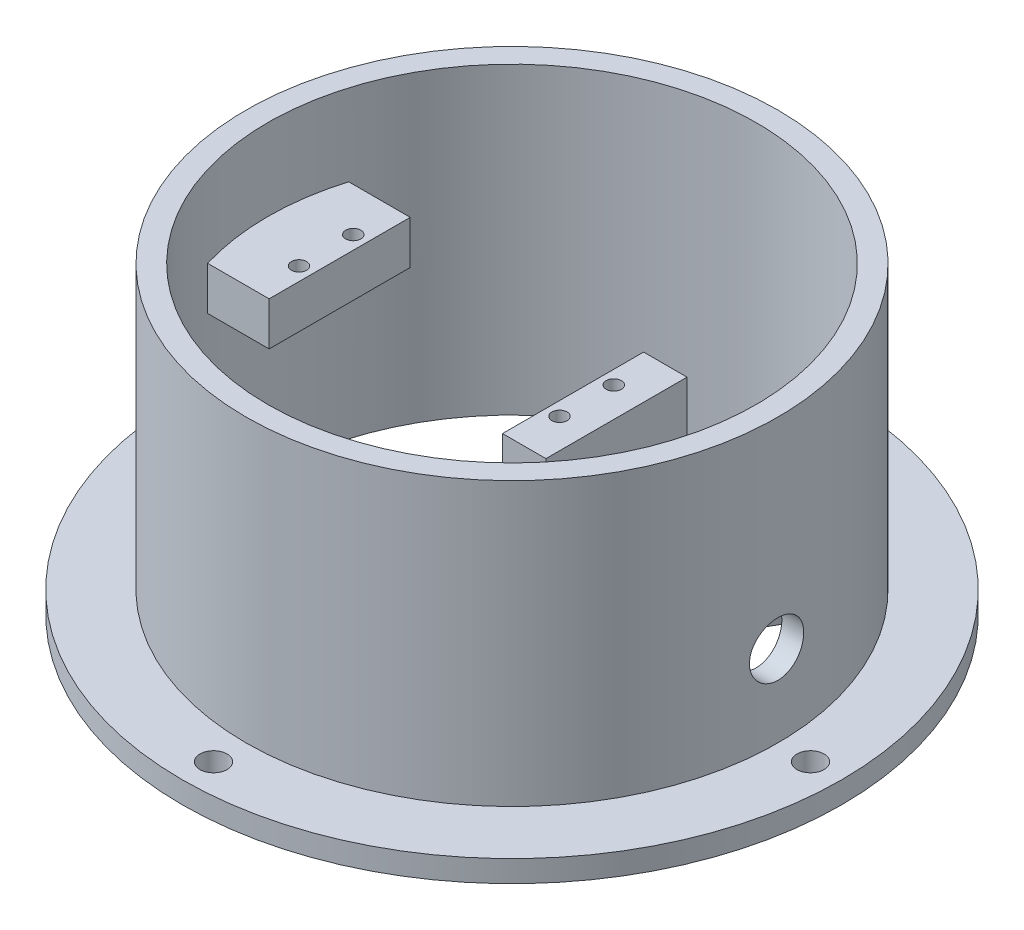
from build123d import *

# Parameters (mm, degrees)
SKETCH1_R           = 60.75
SKETCH1_R_2         = 45
BOSS_EXTRUDE1_DEPTH = 4
SKETCH2_R           = 49
SKETCH2_R_2         = 45
BOSS_EXTRUDE2_DEPTH = 52
SKETCH4_W           = 8
SKETCH4_H           = 41
SKETCH4_W_2         = 15
SKETCH4_H_2         = 8
BOSS_EXTRUDE3_DEPTH = 13
SKETCH6_W           = 10
SKETCH6_H           = 26
CUT_EXTRUDE1_DEPTH  = 26
SKETCH7_R           = 5
CUT_EXTRUDE2_DEPTH  = 110.592711893
SKETCH8_R           = 1.4
CUT_EXTRUDE7_DEPTH  = 7.2
BOSS_EXTRUDE4_DEPTH = 4
SKETCH12_R          = 2.5
CUT_EXTRUDE8_DEPTH  = 101.424723103


with BuildPart() as part:
    # Sketch1 → Boss-Extrude1 (new body)
    with BuildSketch(Plane(origin=(0, 0, 0), x_dir=(1, 0, 0), z_dir=(0, 1, 0))):
        with Locations(Location((0, 0, 0), (0, 0, 270))):
            Circle(SKETCH1_R)
        with Locations(Location((0, 0, 0), (0, 0, 270))):
            Circle(SKETCH1_R_2, mode=Mode.SUBTRACT)
    extrude(amount=BOSS_EXTRUDE1_DEPTH)

    # Sketch2 → Boss-Extrude2 (add)
    with BuildSketch(Plane(origin=(0, 4, 0), x_dir=(1, 0, 0), z_dir=(0, 1, 0))):
        with Locations(Location((0, 0, 0), (0, 0, 90))):
            Circle(SKETCH2_R)
        with Locations(Location((0, 0, 0), (0, 0, 270))):
            Circle(SKETCH2_R_2, mode=Mode.SUBTRACT)
    extrude(amount=BOSS_EXTRUDE2_DEPTH)

    # Sketch4 → Boss-Extrude3 (add, symmetric)
    with BuildSketch(Plane.XY):
        with Locations((15.25, 20.5)):
            Rectangle(SKETCH4_W, SKETCH4_H)
        with Locations((-39.25, 37)):
            Rectangle(SKETCH4_W_2, SKETCH4_H_2)
    extrude(amount=BOSS_EXTRUDE3_DEPTH, both=True)


with BuildPart() as boss_extrude3_piece_1:
    # of the separate pieces the step leaves, piece 1, a body of its own (boss_extrude3_pieces)
    add(part.part.solids().sort_by_distance((0, 0, 60.75))[0])

    # Sketch7 → Cut-Extrude2 (cut, through all)
    with BuildSketch(Plane.ZY.offset(-11.25)):
        with Locations(Location((0, 19, 0), (0, 0, 270))):
            Circle(SKETCH7_R)
    extrude(amount=-CUT_EXTRUDE2_DEPTH, mode=Mode.SUBTRACT)


with BuildPart() as boss_extrude3_piece_2:
    # of the separate pieces the step leaves, piece 2, a body of its own (boss_extrude3_pieces)
    add(part.part.solids().sort_by_distance((11.25, 41, -13))[0])

    # Sketch6 → Cut-Extrude1 (cut)
    with BuildSketch(Plane.ZY.offset(-11.25)):
        with Locations((0, 18)):
            Rectangle(SKETCH6_W, SKETCH6_H)
    extrude(amount=-CUT_EXTRUDE1_DEPTH, mode=Mode.SUBTRACT)


with BuildPart() as cut_extrude7_tool:
    # Sketch8 → Cut-Extrude7 (new body)
    with BuildSketch(Plane(origin=(0, 41, 0), x_dir=(1, 0, 0), z_dir=(0, 1, 0))):
        with Locations(Location((-34.25, -5, 0), (0, 0, 270))):
            Circle(SKETCH8_R)
        with Locations(Location((13.75, -5, 0), (0, 0, 270))):
            Circle(SKETCH8_R)
        with Locations(Location((13.75, 5, 0), (0, 0, 90))):
            Circle(SKETCH8_R)
        with Locations(Location((-34.25, 5, 0), (0, 0, 90))):
            Circle(SKETCH8_R)
    extrude(amount=-CUT_EXTRUDE7_DEPTH)


with BuildPart() as boss_extrude3_piece_1_1:
    add(boss_extrude3_piece_1.part)

    # Cut-Extrude7: cut by cut_extrude7_tool
    add(cut_extrude7_tool.part, mode=Mode.SUBTRACT)



with BuildPart() as boss_extrude3_piece_2_1:
    add(boss_extrude3_piece_2.part)

    # Cut-Extrude7: cut by cut_extrude7_tool
    add(cut_extrude7_tool.part, mode=Mode.SUBTRACT)


with BuildPart() as boss_extrude3_piece_1_2:
    add(boss_extrude3_piece_1_1.part)

    add(boss_extrude3_piece_2_1.part)  # Boss-Extrude4 merges Boss-Extrude3 piece 2
    # Sketch9 → Boss-Extrude4 (add)
    with BuildSketch(Plane.XZ):
        with BuildLine():
            Line((11.25, -13), (25.249838503, -37.248431585))
            ThreePointArc((25.249838503, -37.248431585), (45, 0), (25.249838503, 37.248431585))
            Line((25.249838503, 37.248431585), (11.25, 13))
            Line((11.25, 13), (19.25, 13))
            Line((19.25, 13), (19.25, -13))
            Line((19.25, -13), (11.25, -13))
        make_face()
        with BuildLine():
            ThreePointArc((27.361802413, -24.906460381), (37, 0), (27.361802413, 24.906460381))
            Line((27.361802413, 24.906460381), (24.25, 19.516660498))
            Line((24.25, 19.516660498), (24.25, -19.516660498))
            Line((24.25, -19.516660498), (27.361802413, -24.906460381))
        make_face(mode=Mode.SUBTRACT)
    extrude(amount=-BOSS_EXTRUDE4_DEPTH)

    # Sketch12 → Cut-Extrude8 (cut, through all)
    with BuildSketch(Plane(origin=(0, 4, 0), x_dir=(1, 0, 0), z_dir=(0, 1, 0))):
        with Locations(Location((-55, 0, 0), (0, 0, 270))):
            Circle(SKETCH12_R)
        with Locations(Location((0, 55, 0), (0, 0, 270))):
            Circle(SKETCH12_R)
        with Locations(Location((55, 0, 0), (0, 0, 270))):
            Circle(SKETCH12_R)
        with Locations(Location((0, -55, 0), (0, 0, 270))):
            Circle(SKETCH12_R)
    extrude(amount=-CUT_EXTRUDE8_DEPTH, mode=Mode.SUBTRACT)


solid = boss_extrude3_piece_1_2.part
